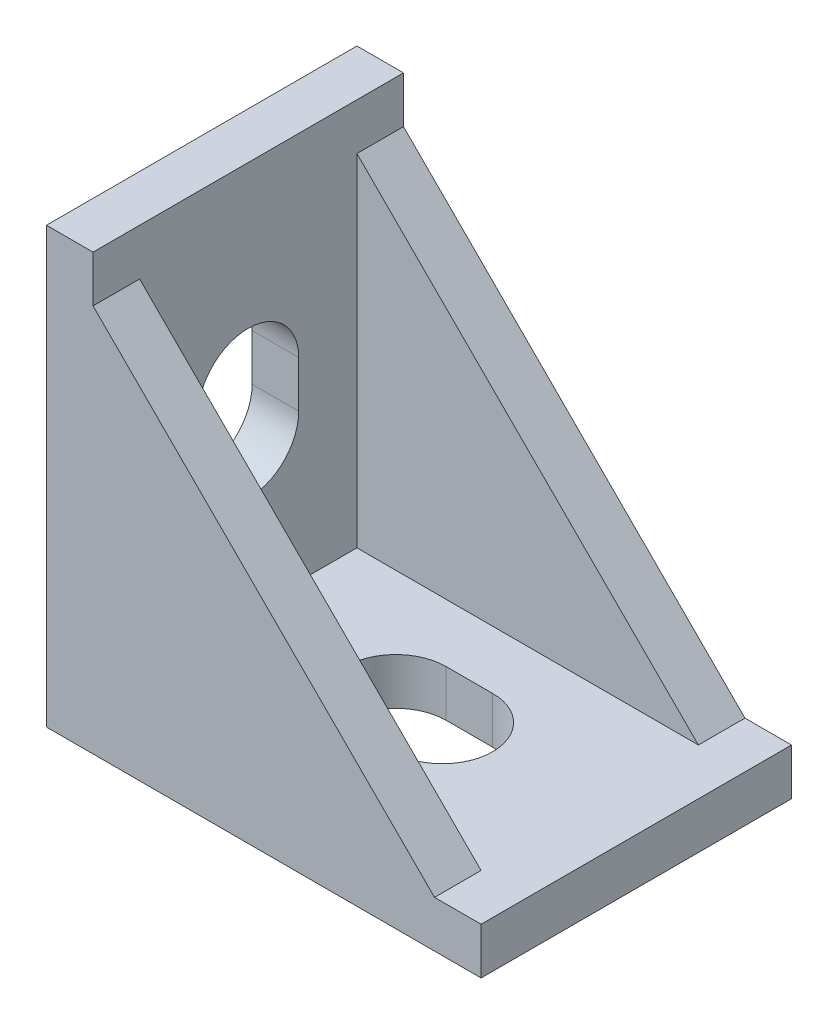
from build123d import *

# Parameters (mm, degrees)
BOSS_EXTRUDE1_DEPTH = 20
SKETCH2_W           = 22
SKETCH2_H           = 14
CUT_EXTRUDE1_DEPTH  = 43.532340636
CUT_EXTRUDE2_DEPTH  = 45.362146026


with BuildPart() as part:
    # Sketch1 → Boss-Extrude1 (new body)
    with BuildSketch(Plane.XY):
        Polygon((0, 0), (0, 28), (3, 28), (3, 25), (25, 3), (28, 3), (28, 0), align=None)
    extrude(amount=BOSS_EXTRUDE1_DEPTH)

    # Sketch2 → Cut-Extrude1 (cut, through all)
    with BuildSketch(Plane(origin=(0, 3, 0), x_dir=(1, 0, 0), z_dir=(0, 1, 0))):
        with Locations((14, -10)):
            Rectangle(SKETCH2_W, SKETCH2_H)
    extrude(amount=CUT_EXTRUDE1_DEPTH, mode=Mode.SUBTRACT)

    # Sketch3 → Cut-Extrude2 (cut, through all)
    with BuildSketch(Plane.XZ):
        with BuildLine():
            Line((15.5, 6.75), (12.5, 6.75))
            ThreePointArc((12.5, 6.75), (9.25, 10), (12.5, 13.25))
            Line((12.5, 13.25), (15.5, 13.25))
            ThreePointArc((15.5, 13.25), (18.75, 10), (15.5, 6.75))
        make_face()
    cut_extrude2 = extrude(amount=-CUT_EXTRUDE2_DEPTH, mode=Mode.SUBTRACT)

    # Mirror1: Cut-Extrude2 across plane
    add(cut_extrude2.mirror(Plane(origin=(0, 0, 0), x_dir=(0, 0, 1), z_dir=(-0.7071067811865487, 0.7071067811865464, 0))), mode=Mode.SUBTRACT)


solid = part.part
